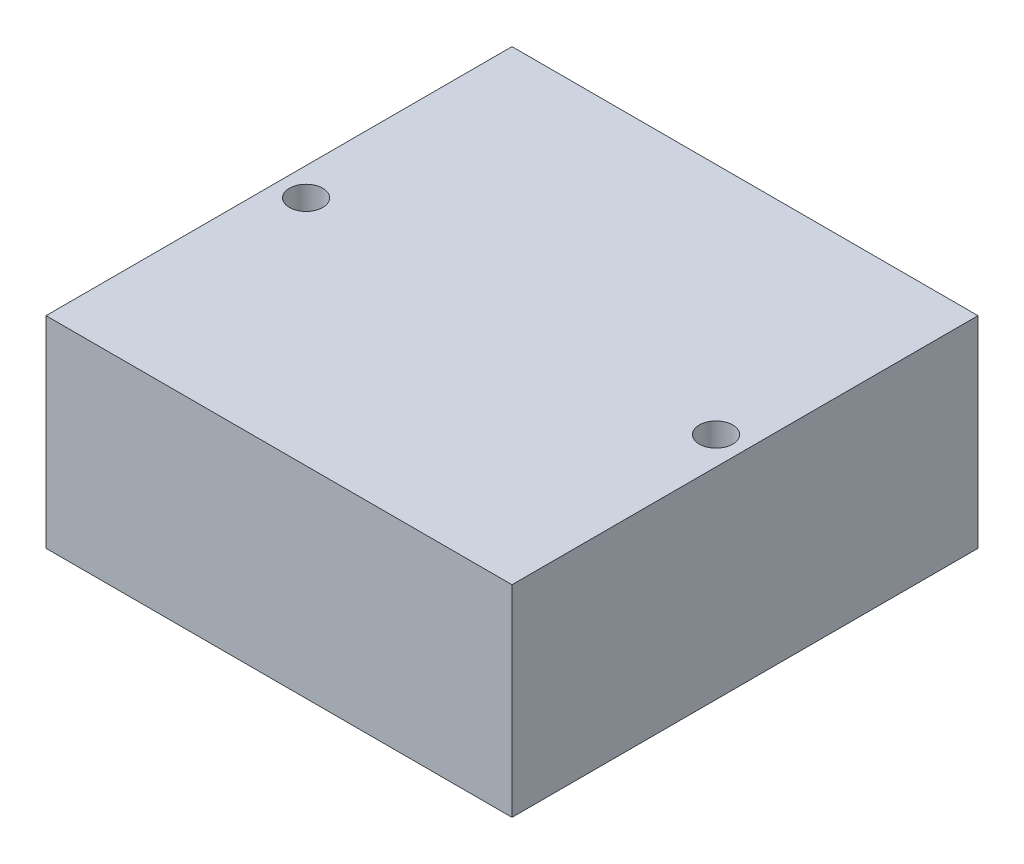
from build123d import *

# Parameters (mm, degrees)
SKETCH1_W           = 74
SKETCH1_H           = 74
SKETCH1_R           = 2.65
BOSS_EXTRUDE1_DEPTH = 32


with BuildPart() as part:
    # Sketch1 → Boss-Extrude1 (new body)
    with BuildSketch(Plane(origin=(0, 0, 0), x_dir=(1, 0, 0), z_dir=(0, 1, 0))):
        with Locations((37, 37)):
            Rectangle(SKETCH1_W, SKETCH1_H)
        with Locations(Location((4.45, 36.85, 0), (0, 0, 270))):
            Circle(SKETCH1_R, mode=Mode.SUBTRACT)
        with Locations(Location((69.55, 36.85, 0), (0, 0, 270))):
            Circle(SKETCH1_R, mode=Mode.SUBTRACT)
    extrude(amount=BOSS_EXTRUDE1_DEPTH)


solid = part.part
